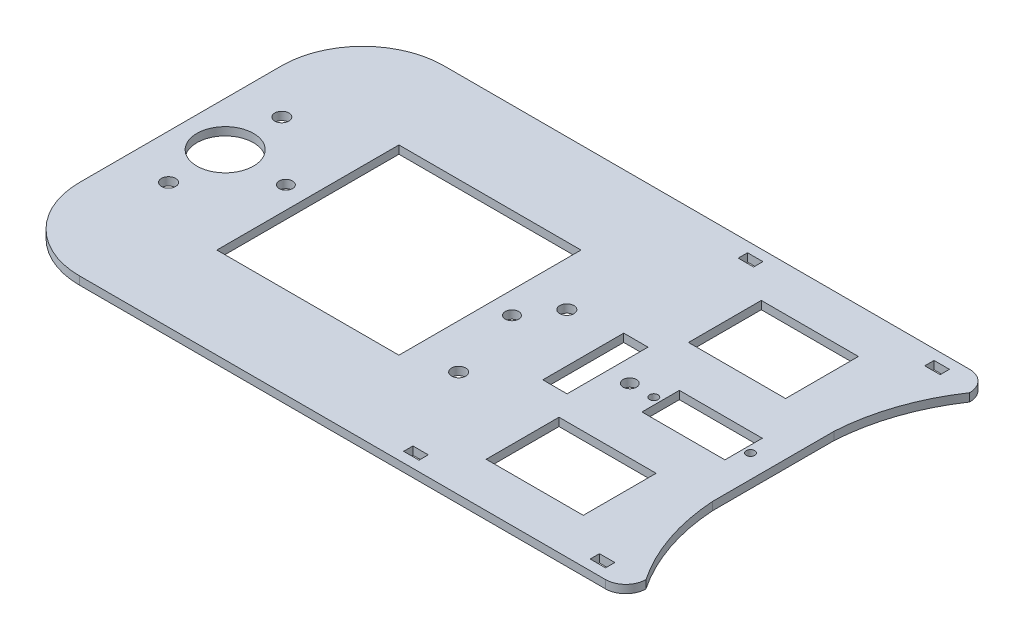
from build123d import *

# Parameters (mm, degrees)
CROQUIS1_R              = 1.75
CROQUIS1_R_2            = 1.05
CROQUIS1_R_3            = 1.65
CROQUIS1_R_4            = 7
CROQUIS1_W              = 24
CROQUIS1_H              = 18
CROQUIS1_W_2            = 20.5
CROQUIS1_H_2            = 9.25
CROQUIS1_W_3            = 3.8
CROQUIS1_H_3            = 2.3
CROQUIS1_W_4            = 6
CROQUIS1_H_4            = 20
CROQUIS1_W_5            = 45
CROQUIS1_H_5            = 45
SALIENTE_EXTRUIR1_DEPTH = 2


with BuildPart() as part:
    # Croquis1 → Saliente-Extruir1 (new body)
    with BuildSketch(Plane(origin=(0, 0, 0), x_dir=(1, 0, 0), z_dir=(0, 1, 0))):
        with BuildLine():
            Line((-49.462248263, -45), (80.537751737, -45))
            ThreePointArc((80.537751737, -45), (84.073285643, -43.535533906), (85.537751737, -40))
            ThreePointArc((85.537751737, -40), (79.612228902, -28.069677764), (77.037751737, -15))
            Line((77.037751737, -15), (77.037751737, 15))
            ThreePointArc((77.037751737, 15), (79.612228902, 28.069677764), (85.537751737, 40))
            ThreePointArc((85.537751737, 40), (84.073285643, 43.535533906), (80.537751737, 45))
            Line((80.537751737, 45), (-49.462248263, 45))
            ThreePointArc((-49.462248263, 45), (-63.604383887, 39.142135624), (-69.462248263, 25))
            Line((-69.462248263, 25), (-69.462248263, -25))
            ThreePointArc((-69.462248263, -25), (-63.604383887, -39.142135624), (-49.462248263, -45))
        make_face()
        with Locations(Location((-58.462248263, -14, 0), (0, 0, 270))):
            Circle(CROQUIS1_R, mode=Mode.SUBTRACT)
        with Locations(Location((-58.462248263, 14, 0), (0, 0, 90))):
            Circle(CROQUIS1_R, mode=Mode.SUBTRACT)
        with Locations(Location((71.365251737, 0, 0), (0, 0, 270))):
            Circle(CROQUIS1_R_2, mode=Mode.SUBTRACT)
        with Locations(Location((47.465251737, 0, 0), (0, 0, 270))):
            Circle(CROQUIS1_R_2, mode=Mode.SUBTRACT)
        with Locations(Location((-43.462248263, 0, 0), (0, 0, 270))):
            Circle(CROQUIS1_R_3, mode=Mode.SUBTRACT)
        with Locations(Location((12.417751737, 0, 0), (0, 0, 270))):
            Circle(CROQUIS1_R_3, mode=Mode.SUBTRACT)
        with Locations(Location((-58.462248263, 0, 0), (0, 0, 270))):
            Circle(CROQUIS1_R_4, mode=Mode.SUBTRACT)
        with Locations(Location((41.537751737, 0, 0), (0, 0, 270))):
            Circle(CROQUIS1_R_3, mode=Mode.SUBTRACT)
        with Locations(Location((17.977751737, 8, 0), (0, 0, 270))):
            Circle(CROQUIS1_R, mode=Mode.SUBTRACT)
        with Locations(Location((17.977751737, -18.7345, 0), (0, 0, 270))):
            Circle(CROQUIS1_R, mode=Mode.SUBTRACT)
        with Locations((52.037751737, -25)):
            Rectangle(CROQUIS1_W, CROQUIS1_H, mode=Mode.SUBTRACT)
        with Locations((59.415251737, 0)):
            Rectangle(CROQUIS1_W_2, CROQUIS1_H_2, mode=Mode.SUBTRACT)
        with Locations((30.037751737, 41.35)):
            Rectangle(CROQUIS1_W_3, CROQUIS1_H_3, mode=Mode.SUBTRACT)
        with Locations((76.137751737, 41.35)):
            Rectangle(CROQUIS1_W_3, CROQUIS1_H_3, mode=Mode.SUBTRACT)
        with Locations((76.137751737, -41.35)):
            Rectangle(CROQUIS1_W_3, CROQUIS1_H_3, mode=Mode.SUBTRACT)
        with Locations((30.037751737, -41.35)):
            Rectangle(CROQUIS1_W_3, CROQUIS1_H_3, mode=Mode.SUBTRACT)
        with Locations((33.037751737, 0)):
            Rectangle(CROQUIS1_W_4, CROQUIS1_H_4, mode=Mode.SUBTRACT)
        with Locations((-15.522248263, 0)):
            Rectangle(CROQUIS1_W_5, CROQUIS1_H_5, mode=Mode.SUBTRACT)
        with Locations((52.037751737, 25)):
            Rectangle(CROQUIS1_W, CROQUIS1_H, mode=Mode.SUBTRACT)
    extrude(amount=SALIENTE_EXTRUIR1_DEPTH)


solid = part.part
